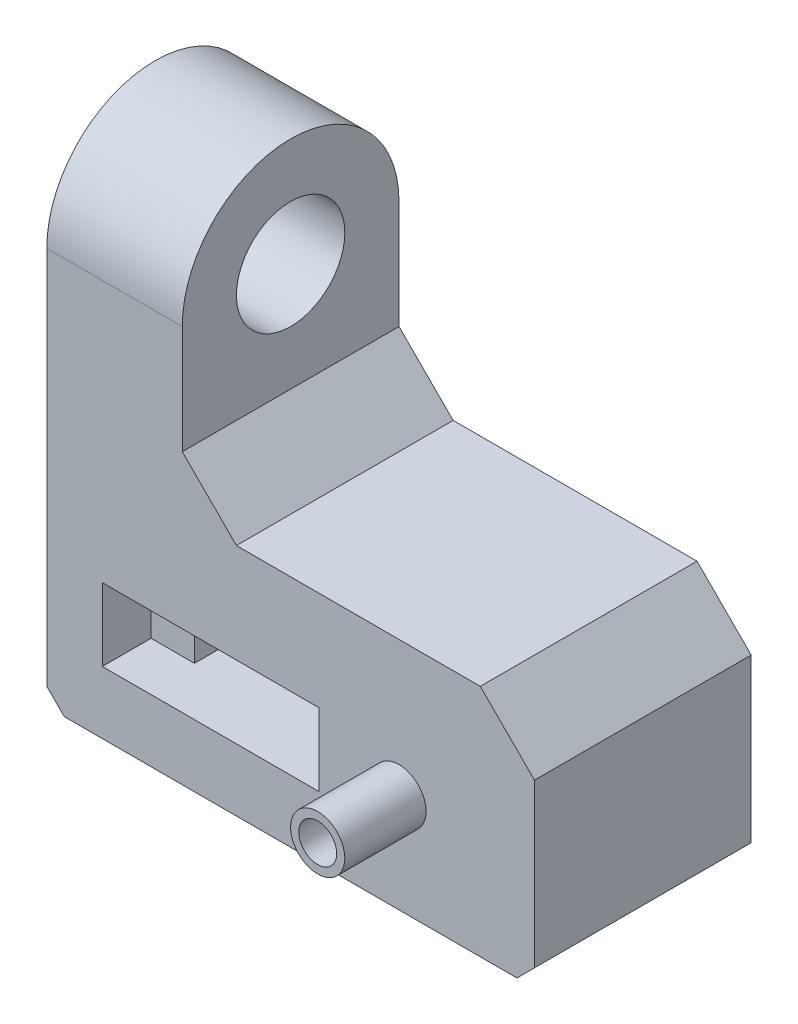
from build123d import *

# Parameters (mm, degrees)
SKETCH1_W           = 90
SKETCH1_H           = 50
BOSS_EXTRUDE1_DEPTH = 40
SKETCH22_W          = 40
SKETCH22_H          = 13.4
CUT_EXTRUDE11_DEPTH = 9
SKETCH24_W          = 24
SKETCH24_H          = 13.4
CUT_EXTRUDE12_DEPTH = 31
SKETCH25_R          = 1.1
CUT_EXTRUDE13_DEPTH = 31
SKETCH31_W          = 25
SKETCH31_H          = 40
BOSS_EXTRUDE2_DEPTH = 50
SKETCH32_R          = 10
CUT_EXTRUDE15_DEPTH = 25
CHAMFER1_SIZE       = 10
CUT_EXTRUDE16_REACH = 142.357
SKETCH35_W          = 15
SKETCH35_H          = 20
SKETCH36_W          = 12
SKETCH36_H          = 12
SKETCH36_R          = 3.5
BOSS_EXTRUDE3_DEPTH = 10
SKETCH37_W          = 95.999091547
SKETCH37_H          = 21.11006165
CUT_EXTRUDE17_DEPTH = 100
SKETCH21_R          = 5
BOSS_EXTRUDE4_DEPTH = 15
SKETCH38_R          = 3.5
CUT_EXTRUDE18_DEPTH = 10
BOSS_EXTRUDE5_START = -7.186432503
SKETCH39_R          = 1.1
BOSS_EXTRUDE5_DEPTH = 7.186432503


with BuildPart() as part:
    # Sketch1 → Boss-Extrude1 (new body)
    with BuildSketch(Plane.XY):
        with Locations((-45, 25)):
            Rectangle(SKETCH1_W, SKETCH1_H)
    extrude(amount=BOSS_EXTRUDE1_DEPTH)

    # Sketch22 → Cut-Extrude11 (cut)
    with BuildSketch(Plane.XY.offset(40)):
        with Locations((-59.75, 25)):
            Rectangle(SKETCH22_W, SKETCH22_H)
    extrude(amount=-CUT_EXTRUDE11_DEPTH, mode=Mode.SUBTRACT)

    # Sketch24 → Cut-Extrude12 (cut)
    with BuildSketch(Plane.XY.offset(31)):
        with Locations((-59.75, 25)):
            Rectangle(SKETCH24_W, SKETCH24_H)
    extrude(amount=-CUT_EXTRUDE12_DEPTH, mode=Mode.SUBTRACT)

    # Sketch25 → Cut-Extrude13 (cut)
    with BuildSketch(Plane.XY.offset(31)):
        with Locations((-73.25, 25)):
            Circle(SKETCH25_R)
        with Locations((-46.25, 25)):
            Circle(SKETCH25_R)
    extrude(amount=-CUT_EXTRUDE13_DEPTH, mode=Mode.SUBTRACT)

    # Sketch31 → Boss-Extrude2 (add)
    with BuildSketch(Plane(origin=(0, 50, 0), x_dir=(1, 0, 0), z_dir=(0, 1, 0))):
        with Locations((-77.5, -20)):
            Rectangle(SKETCH31_W, SKETCH31_H)
    extrude(amount=BOSS_EXTRUDE2_DEPTH)

    # Sketch32 → Cut-Extrude15 (cut)
    with BuildSketch(Plane(origin=(-65, 0, 0), x_dir=(0, 0, -1), z_dir=(1, 0, 0))):
        with BuildLine():
            ThreePointArc((-40, 80), (-34.142135624, 94.142135624), (-20, 100))
            Line((-20, 100), (-40, 100))
            Line((-40, 100), (-40, 80))
        make_face()
        with BuildLine():
            ThreePointArc((-20, 100), (-5.857864376, 94.142135624), (0, 80))
            Line((0, 80), (0, 100))
            Line((0, 100), (-20, 100))
        make_face()
        with Locations((-20, 80)):
            Circle(SKETCH32_R)
    extrude(amount=-CUT_EXTRUDE15_DEPTH, mode=Mode.SUBTRACT)

    # Chamfer1
    chamfer1_edges = [part.edges().sort_by_distance(p)[0] for p in [
        (-65, 50, 20),
        (0, 50, 20),
        (0, 0, 20),
        (-90, 0, 20),
    ]]
    chamfer(chamfer1_edges, length=CHAMFER1_SIZE)

    # Cut-Extrude16: up to this face of the body (flat: up to its plane)
    cut_extrude16_end = Plane(part.part.faces().sort_by_distance((-47.75, 25, 15.5))[0])
    # Sketch35 → Cut-Extrude16 (cut, up to the picked face)
    with BuildSketch(Plane.ZY.offset(90), mode=Mode.PRIVATE) as cut_extrude16_sk1:
        with Locations((14.686432503, 25)):
            Rectangle(SKETCH35_W, SKETCH35_H)
    cut_extrude16_tool1 = split(extrude(cut_extrude16_sk1.sketch, amount=-CUT_EXTRUDE16_REACH, mode=Mode.PRIVATE), bisect_by=cut_extrude16_end, keep=Keep.BOTH, mode=Mode.PRIVATE)
    add(cut_extrude16_tool1.solids().sort_by(Axis((-90, 25, 14.686433), (1, 0, 0)))[0], mode=Mode.SUBTRACT)

    # Sketch36 → Boss-Extrude3 (add)
    # profile 1 of 2: a face of its own
    with BuildSketch(Plane.XY.offset(40)):
        with Locations((-65, -6)):
            Rectangle(SKETCH36_W, SKETCH36_H)
        with Locations((-65, -6)):
            Circle(SKETCH36_R, mode=Mode.SUBTRACT)
    # profile 2 of 2: a face of its own
    with BuildSketch(Plane.XY.offset(40)):
        with Locations((-25, -6)):
            Rectangle(SKETCH36_W, SKETCH36_H)
        with Locations((-25, -6)):
            Circle(SKETCH36_R, mode=Mode.SUBTRACT)
    extrude(amount=-BOSS_EXTRUDE3_DEPTH)

    # Sketch37 → Cut-Extrude17 (cut)
    with BuildSketch(Plane.XY.offset(40)):
        with Locations((-45.7868778, -3.784559742)):
            Rectangle(SKETCH37_W, SKETCH37_H)
    extrude(amount=-CUT_EXTRUDE17_DEPTH, mode=Mode.SUBTRACT)

    # Sketch21 → Boss-Extrude4 (add)
    with BuildSketch(Plane.XY.offset(40)):
        with Locations((-25, 25)):
            Circle(SKETCH21_R)
    extrude(amount=BOSS_EXTRUDE4_DEPTH)

    # Sketch38 → Cut-Extrude18 (cut)
    with BuildSketch(Plane.XY.offset(55)):
        with Locations((-25, 25)):
            Circle(SKETCH38_R)
    extrude(amount=-CUT_EXTRUDE18_DEPTH, mode=Mode.SUBTRACT)

    # Sketch39 → Boss-Extrude5 (add)
    with BuildSketch(Plane(origin=(0, 0, 0), x_dir=(-1, 0, 0), z_dir=(0, 0, -1)).offset(BOSS_EXTRUDE5_START)):
        with Locations(Location((46.25, 25, 0), (0, 0, 180))):
            Circle(SKETCH39_R)
        with Locations(Location((73.25, 25, 0), (0, 0, 180))):
            Circle(SKETCH39_R)
    extrude(amount=BOSS_EXTRUDE5_DEPTH)


solid = part.part
